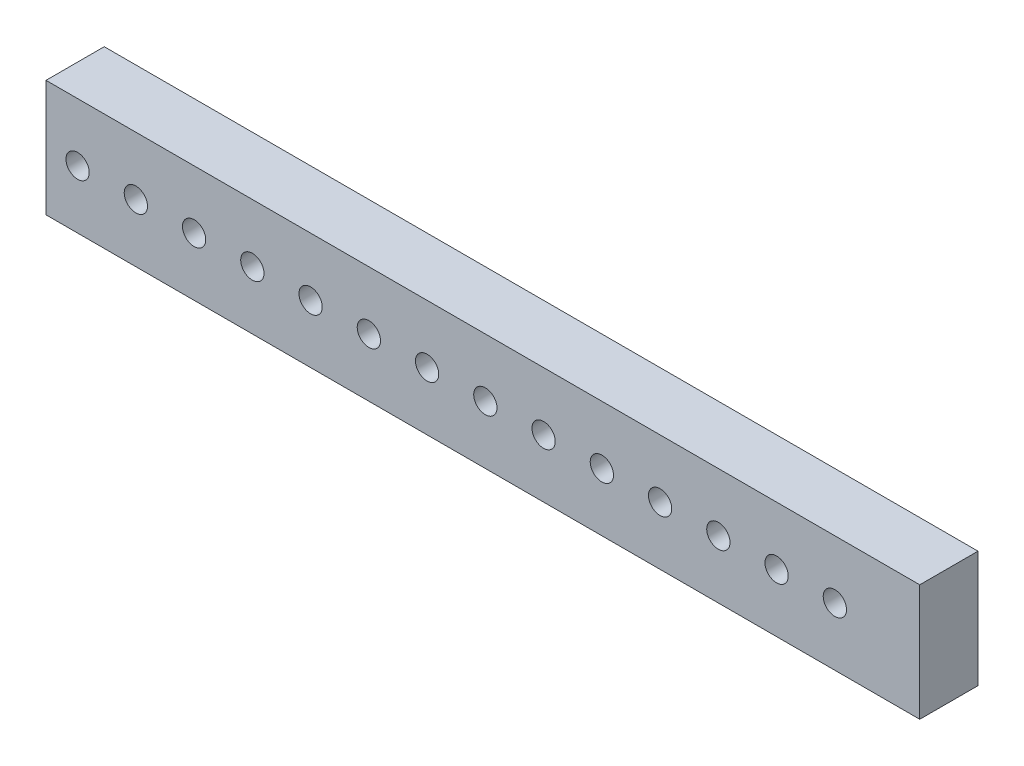
from build123d import *

# Parameters (mm, degrees)
SKETCH_1_W          = 150
SKETCH_1_H          = 20
EXTRUDE_1_DEPTH     = 10
SKETCH_2_R          = 2
CUT_EXTRUDE_1_DEPTH = 10


with BuildPart() as part:
    # 草图1 → 凸台-拉伸1 (new body)
    with BuildSketch(Plane.XY):
        Rectangle(SKETCH_1_W, SKETCH_1_H)
    extrude(amount=EXTRUDE_1_DEPTH)

    # 草图2 → 切除-拉伸1 (cut)
    with BuildSketch(Plane(origin=(0, 0, 0), x_dir=(-1, 0, 0), z_dir=(0, 0, -1))):
        with Locations((69.573976668, 0)):
            Circle(SKETCH_2_R)
        with Locations((59.573976668, 0)):
            Circle(SKETCH_2_R)
        with Locations((49.573976668, 0)):
            Circle(SKETCH_2_R)
        with Locations((39.573976668, 0)):
            Circle(SKETCH_2_R)
        with Locations((29.573976668, 0)):
            Circle(SKETCH_2_R)
        with Locations((19.573976668, 0)):
            Circle(SKETCH_2_R)
        with Locations((9.573976668, 0)):
            Circle(SKETCH_2_R)
        with Locations((-0.426023332, 0)):
            Circle(SKETCH_2_R)
        with Locations((-10.426023332, 0)):
            Circle(SKETCH_2_R)
        with Locations((-20.426023332, 0)):
            Circle(SKETCH_2_R)
        with Locations((-30.426023332, 0)):
            Circle(SKETCH_2_R)
        with Locations((-40.426023332, 0)):
            Circle(SKETCH_2_R)
        with Locations((-50.426023332, 0)):
            Circle(SKETCH_2_R)
        with Locations((-60.426023332, 0)):
            Circle(SKETCH_2_R)
    extrude(amount=-CUT_EXTRUDE_1_DEPTH, mode=Mode.SUBTRACT)


solid = part.part
